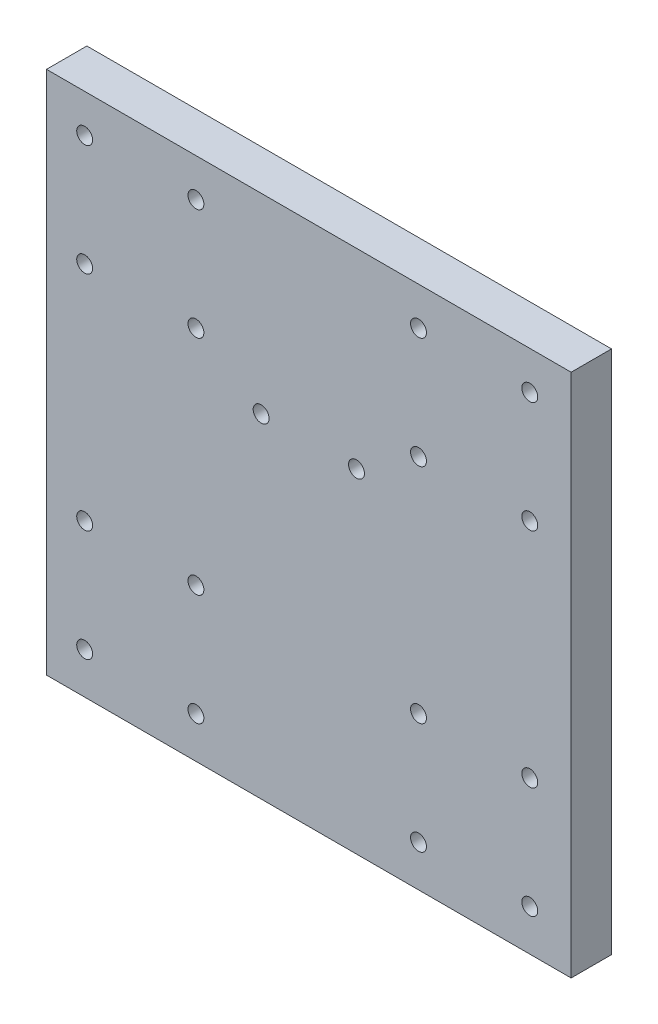
from build123d import *

# Parameters (mm, degrees)
CROQUIS1_W              = 165
CROQUIS1_H              = 165
CROQUIS1_R              = 2.5
SALIENTE_EXTRUIR1_DEPTH = 12.7
CORTAR_EXTRUIR1_START   = -12.7
CROQUIS2_R              = 2.5
CORTAR_EXTRUIR1_DEPTH   = 12.7


with BuildPart() as part:
    # Croquis1 → Saliente-Extruir1 (new body)
    with BuildSketch(Plane.XY):
        Rectangle(CROQUIS1_W, CROQUIS1_H)
        with Locations((-70.5, 70.5)):
            Circle(CROQUIS1_R, mode=Mode.SUBTRACT)
        with Locations((-35.5, 70.5)):
            Circle(CROQUIS1_R, mode=Mode.SUBTRACT)
        with Locations((-35.5, 35.5)):
            Circle(CROQUIS1_R, mode=Mode.SUBTRACT)
        with Locations((-70.5, 35.5)):
            Circle(CROQUIS1_R, mode=Mode.SUBTRACT)
        with Locations((34.5, 70.5)):
            Circle(CROQUIS1_R, mode=Mode.SUBTRACT)
        with Locations((69.5, 70.5)):
            Circle(CROQUIS1_R, mode=Mode.SUBTRACT)
        with Locations((69.5, 35.5)):
            Circle(CROQUIS1_R, mode=Mode.SUBTRACT)
        with Locations((34.5, 35.5)):
            Circle(CROQUIS1_R, mode=Mode.SUBTRACT)
        with Locations((34.5, -34.5)):
            Circle(CROQUIS1_R, mode=Mode.SUBTRACT)
        with Locations((69.5, -34.5)):
            Circle(CROQUIS1_R, mode=Mode.SUBTRACT)
        with Locations((69.5, -69.5)):
            Circle(CROQUIS1_R, mode=Mode.SUBTRACT)
        with Locations((34.5, -69.5)):
            Circle(CROQUIS1_R, mode=Mode.SUBTRACT)
        with Locations((-70.5, -34.5)):
            Circle(CROQUIS1_R, mode=Mode.SUBTRACT)
        with Locations((-35.5, -34.5)):
            Circle(CROQUIS1_R, mode=Mode.SUBTRACT)
        with Locations((-35.5, -69.5)):
            Circle(CROQUIS1_R, mode=Mode.SUBTRACT)
        with Locations((-70.5, -69.5)):
            Circle(CROQUIS1_R, mode=Mode.SUBTRACT)
    extrude(amount=SALIENTE_EXTRUIR1_DEPTH)

    # Croquis2 → Cortar-Extruir1 (cut)
    with BuildSketch(Plane.XY.offset(12.7).offset(CORTAR_EXTRUIR1_START)):
        with Locations((-15, 22.390106488)):
            Circle(CROQUIS2_R)
        with Locations((15, 22.390106488)):
            Circle(CROQUIS2_R)
        with Locations((69.5, -69.5)):
            Circle(CROQUIS2_R)
        with Locations((69.5, -34.5)):
            Circle(CROQUIS2_R)
        with Locations((34.5, -69.5)):
            Circle(CROQUIS2_R)
        with Locations((34.5, -34.5)):
            Circle(CROQUIS2_R)
        with Locations((-35.5, -69.5)):
            Circle(CROQUIS2_R)
        with Locations((-70.5, -69.5)):
            Circle(CROQUIS2_R)
        with Locations((-35.5, -34.5)):
            Circle(CROQUIS2_R)
        with Locations((-70.5, -34.5)):
            Circle(CROQUIS2_R)
        with Locations((69.5, 35.5)):
            Circle(CROQUIS2_R)
        with Locations((34.5, 35.5)):
            Circle(CROQUIS2_R)
        with Locations((69.5, 70.5)):
            Circle(CROQUIS2_R)
        with Locations((34.5, 70.5)):
            Circle(CROQUIS2_R)
        with Locations((-35.5, 35.5)):
            Circle(CROQUIS2_R)
        with Locations((-70.5, 35.5)):
            Circle(CROQUIS2_R)
        with Locations((-35.5, 70.5)):
            Circle(CROQUIS2_R)
        with Locations((-70.5, 70.5)):
            Circle(CROQUIS2_R)
    extrude(amount=CORTAR_EXTRUIR1_DEPTH, mode=Mode.SUBTRACT)


solid = part.part
